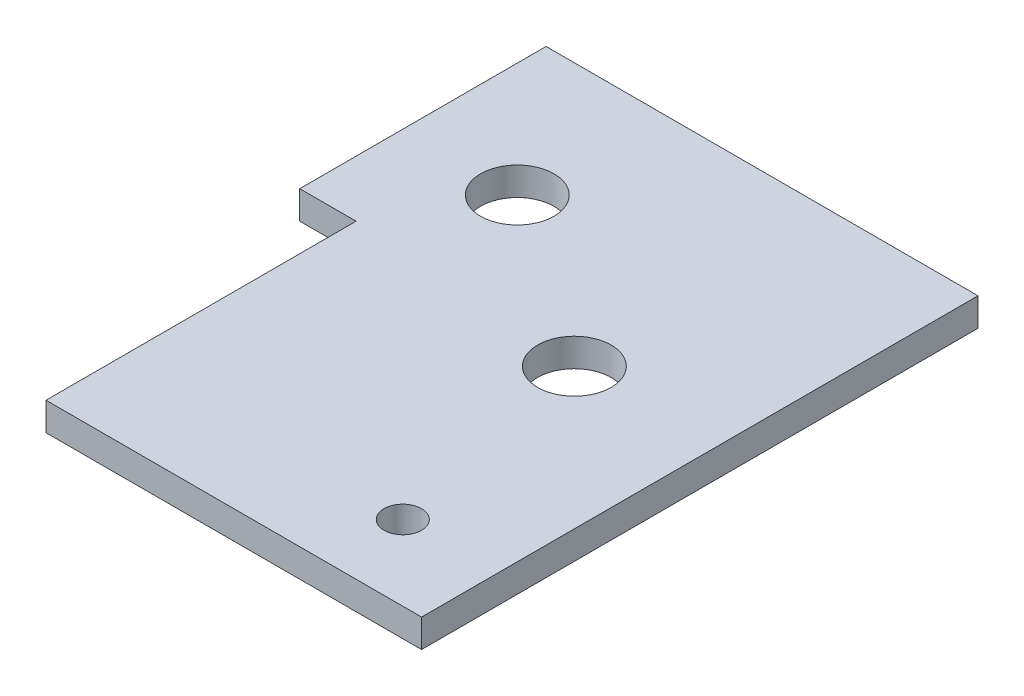
from build123d import *

# Parameters (mm, degrees)
SKETCH1_6_R         = 2
SKETCH1_6_R_2       = 3.915
BOSS_EXTRUDE3_DEPTH = 3


with BuildPart() as part:
    # Sketch1<6> → Boss-Extrude3 (new body)
    with BuildSketch(Plane(origin=(0, 0, 0), x_dir=(1, 0, 0), z_dir=(0, 1, 0))):
        Polygon((152.296761578, -26.969822669), (152.296761578, 32.295700632), (106.296761578, 32.295700632), (106.296761578, 6.055177331), (112.296761578, 6.055177331), (112.296761578, -26.969822669), align=None)
        with Locations((142.296761578, -18.969822669)):
            Circle(SKETCH1_6_R, mode=Mode.SUBTRACT)
        with Locations((118.466761578, 17.055177331)):
            Circle(SKETCH1_6_R_2, mode=Mode.SUBTRACT)
        with Locations((137.296761578, 4.305177331)):
            Circle(SKETCH1_6_R_2, mode=Mode.SUBTRACT)
    extrude(amount=BOSS_EXTRUDE3_DEPTH)


solid = part.part
